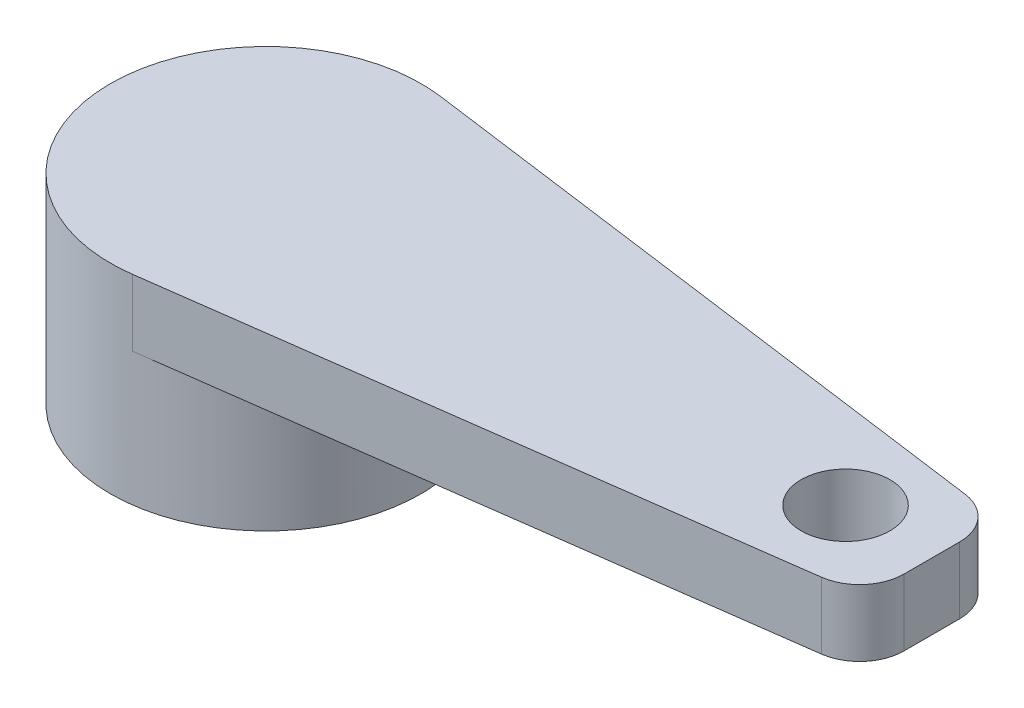
from build123d import *

# Parameters (mm, degrees)
SCHIZZO1_R                   = 3.5
ESTRUSIONE_ESTRUSIONE1_DEPTH = 3
ESTRUSIONE_ESTRUSIONE2_DEPTH = 1.5
SCHIZZO3_R                   = 2.5
TAGLIO_ESTRUSIONE1_DEPTH     = 2
RACCORDO1_R                  = 1
SKETCH2_R                    = 1
CUT_EXTRUDE1_DEPTH           = 17.046806536


with BuildPart() as part:
    # Schizzo1 → Estrusione-Estrusione1 (new body)
    with BuildSketch(Plane(origin=(0, 0, 0), x_dir=(1, 0, 0), z_dir=(0, 1, 0))):
        with Locations(Location((0, 0, 0), (0, 0, 270))):
            Circle(SCHIZZO1_R)
    extrude(amount=ESTRUSIONE_ESTRUSIONE1_DEPTH)

    # Schizzo2 → Estrusione-Estrusione2 (add)
    with BuildSketch(Plane(origin=(0, 3, 0), x_dir=(1, 0, 0), z_dir=(0, 1, 0))):
        with BuildLine():
            Line((15, 1.5), (15, -1.5))
            Line((15, -1.5), (0.469834495, -3.468321719))
            ThreePointArc((0.469834495, -3.468321719), (-3.5, 0), (0.469834495, 3.468321719))
            Line((0.469834495, 3.468321719), (15, 1.5))
        make_face()
    extrude(amount=ESTRUSIONE_ESTRUSIONE2_DEPTH)

    # Schizzo3 → Taglio-Estrusione1 (cut)
    with BuildSketch(Plane.XZ):
        with Locations(Location((0, 0, 0), (0, 0, 270))):
            Circle(SCHIZZO3_R)
    extrude(amount=-TAGLIO_ESTRUSIONE1_DEPTH, mode=Mode.SUBTRACT)

    # Raccordo1
    raccordo1_edges = [part.edges().sort_by_distance(p)[0] for p in [
        (15, 3.75, 1.5),
        (15, 3.75, -1.5),
    ]]
    fillet(raccordo1_edges, radius=RACCORDO1_R)

    # Sketch2 → Cut-Extrude1 (cut, through all)
    with BuildSketch(Plane(origin=(0, 4.5, 0), x_dir=(1, 0, 0), z_dir=(0, 1, 0))):
        with Locations(Location((13, 0.055401887, 0), (0, 0, 270))):
            Circle(SKETCH2_R)
    extrude(amount=-CUT_EXTRUDE1_DEPTH, mode=Mode.SUBTRACT)


solid = part.part
